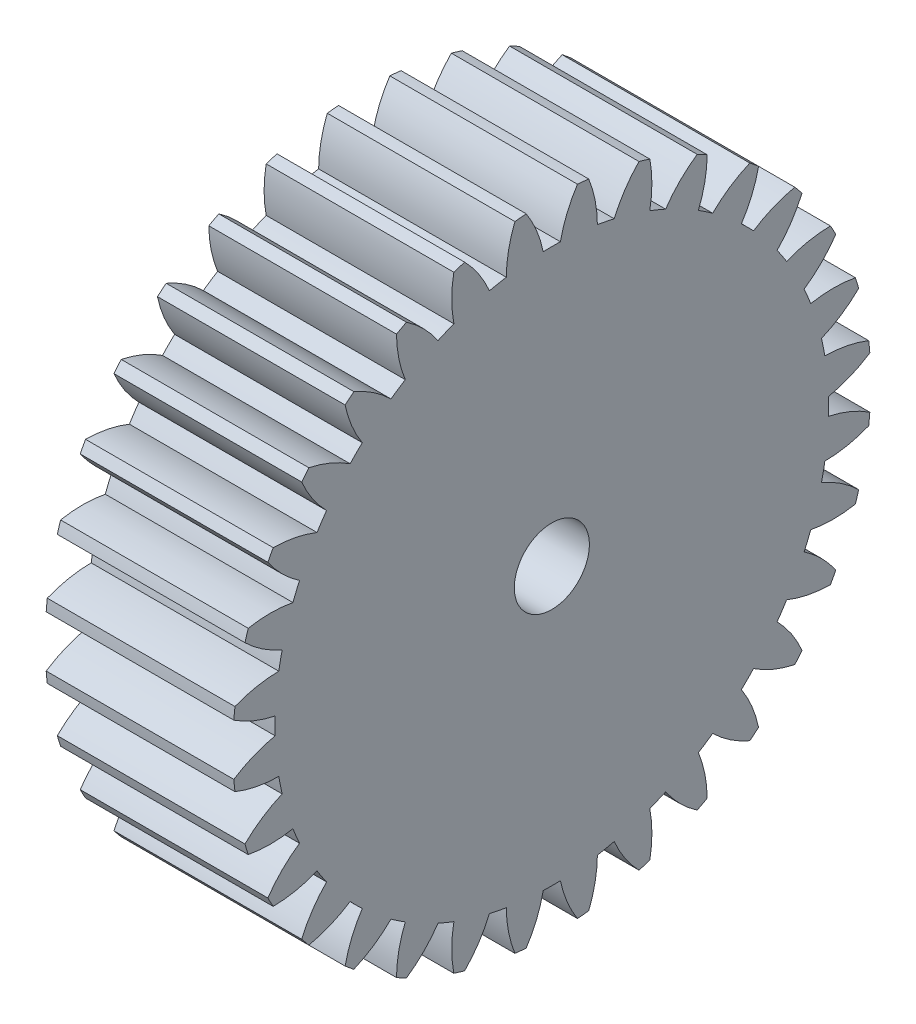
from build123d import *

# Parameters (mm, degrees)
BASPROSKE_W     = 15
BASPROSKE_H     = 25.5
TOOTHCUT_DEPTH  = 40.057649699
TEETHCUTS_COUNT = 32
TEETHCUTS_ANGLE = 348.75
BORSKE_R        = 3
BORE_DEPTH      = 50.0000508


with BuildPart() as part:
    # BasProSke → Base-Revolve (revolve)
    with BuildSketch(Plane(origin=(0, 0, 0), x_dir=(1, 0, 0), z_dir=(0, 1, 0)), mode=Mode.PRIVATE) as base_revolve_sk:
        with Locations((7.5, 12.75)):
            Rectangle(BASPROSKE_W, BASPROSKE_H)
    revolve(base_revolve_sk.sketch.rotate(Axis((-10, 0, 0), (1, 0, 0)), 180), axis=Axis((-10, 0, 0), (1, 0, 0)))

    # TooCutSke → ToothCut (cut, through all)
    with BuildSketch(Plane(origin=(0, 0, 0), x_dir=(0, 0, -1), z_dir=(1, 0, 0))):
        with BuildLine():
            ThreePointArc((0.686701955, 22.113340237), (0, 22.124), (-0.686701955, 22.113340237))
            ThreePointArc((-0.686701955, 22.113340237), (-1.218174602, 23.842764806), (-2.064691256, 25.441758885))
            ThreePointArc((-2.064691256, 25.441758885), (0, 25.5254), (2.064691256, 25.441758885))
            ThreePointArc((2.064691256, 25.441758885), (1.218174602, 23.842764806), (0.686701955, 22.113340237))
        make_face()
    toothcut = extrude(amount=TOOTHCUT_DEPTH, mode=Mode.SUBTRACT)

    # TeethCuts: ToothCut ×32 about axis
    teethcuts_axis = Axis((-10, 0, 0), (1, 0, 0))
    for i in range(1, TEETHCUTS_COUNT):
        add(toothcut.rotate(teethcuts_axis, i * TEETHCUTS_ANGLE / (TEETHCUTS_COUNT - 1)), mode=Mode.SUBTRACT)

    # BorSke → Bore (cut, symmetric)
    with BuildSketch(Plane(origin=(0, 0, 0), x_dir=(0, 0, -1), z_dir=(1, 0, 0))):
        with Locations(Location((0, 0, 0), (0, 0, 180))):
            Circle(BORSKE_R)
    extrude(amount=BORE_DEPTH, both=True, mode=Mode.SUBTRACT)


solid = part.part
